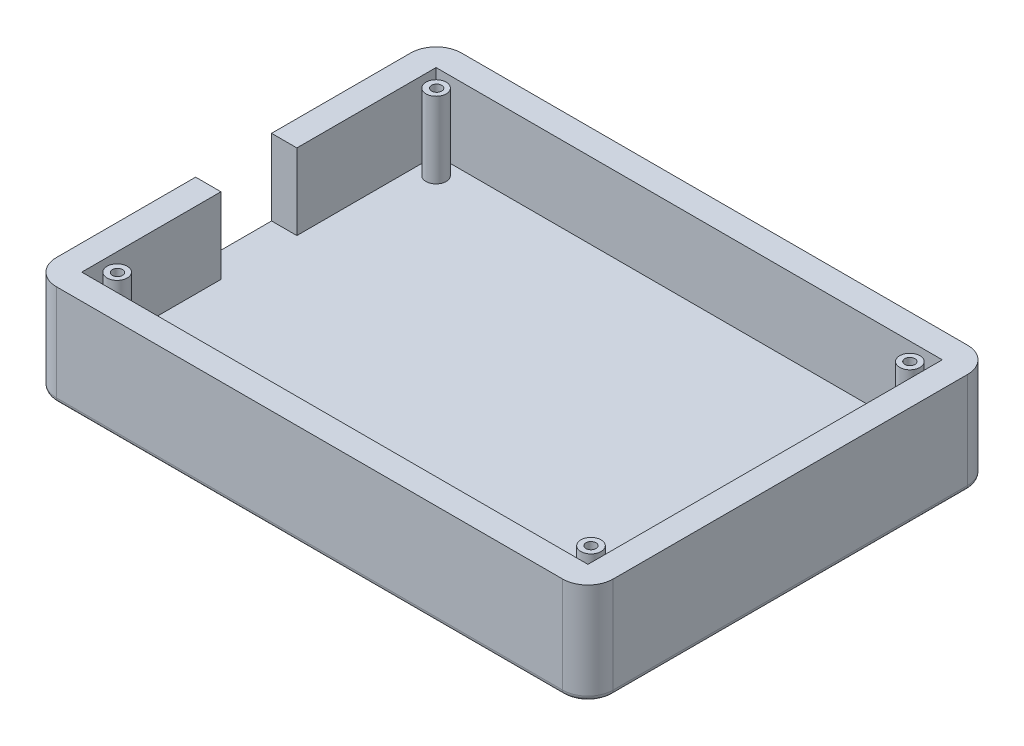
from build123d import *

# Parameters (mm, degrees)
SKETCH4_W           = 110
SKETCH4_H           = 80
BOSS_EXTRUDE1_DEPTH = 20
SHELL1_T            = -5
FILLET1_R           = 5
SKETCH8_W           = 15
SKETCH8_H           = 15
CUT_EXTRUDE2_DEPTH  = 5
SKETCH10_R          = 2
SKETCH10_R_2        = 1
BOSS_EXTRUDE2_DEPTH = 15
FILLET2_R           = 1


with BuildPart() as part:
    # Sketch4 → Boss-Extrude1 (new body)
    with BuildSketch(Plane(origin=(0, 0, 0), x_dir=(1, 0, 0), z_dir=(0, 1, 0))):
        Rectangle(SKETCH4_W, SKETCH4_H)
    extrude(amount=BOSS_EXTRUDE1_DEPTH)

    # Shell1
    shell1_openings = [part.faces().sort_by_distance(p)[0] for p in [
        (0, 20, 0),
    ]]
    offset(amount=SHELL1_T, openings=shell1_openings, kind=Kind.INTERSECTION)

    # Fillet1
    fillet1_edges = [part.edges().sort_by_distance(p)[0] for p in [
        (55, 10, 40),
        (-55, 10, 40),
        (-55, 10, -40),
        (55, 10, -40),
    ]]
    fillet(fillet1_edges, radius=FILLET1_R)

    # Sketch8 → Cut-Extrude2 (cut)
    with BuildSketch(Plane.ZY.offset(55)):
        with Locations((0, 12.5)):
            Rectangle(SKETCH8_W, SKETCH8_H)
    extrude(amount=-CUT_EXTRUDE2_DEPTH, mode=Mode.SUBTRACT)

    # Sketch10 → Boss-Extrude2 (add)
    # profile 1 of 4: a face of its own
    with BuildSketch(Plane(origin=(0, 5, 0), x_dir=(1, 0, 0), z_dir=(0, 1, 0))):
        with Locations(Location((47.1, 31.5, 0), (0, 0, 90))):
            Circle(SKETCH10_R)
        with Locations(Location((47.1, 31.5, 0), (0, 0, 90))):
            Circle(SKETCH10_R_2, mode=Mode.SUBTRACT)
    # profile 2 of 4: a face of its own
    with BuildSketch(Plane(origin=(0, 5, 0), x_dir=(1, 0, 0), z_dir=(0, 1, 0))):
        with Locations(Location((47.1, -31.5, 0), (0, 0, 90))):
            Circle(SKETCH10_R)
        with Locations(Location((47.1, -31.5, 0), (0, 0, 90))):
            Circle(SKETCH10_R_2, mode=Mode.SUBTRACT)
    # profile 3 of 4: a face of its own
    with BuildSketch(Plane(origin=(0, 5, 0), x_dir=(1, 0, 0), z_dir=(0, 1, 0))):
        with Locations(Location((-46.5, 31.5, 0), (0, 0, 90))):
            Circle(SKETCH10_R)
        with Locations(Location((-46.412417336, 31.528728885, 0), (0, 0, 90))):
            Circle(SKETCH10_R_2, mode=Mode.SUBTRACT)
    # profile 4 of 4: a face of its own
    with BuildSketch(Plane(origin=(0, 5, 0), x_dir=(1, 0, 0), z_dir=(0, 1, 0))):
        with Locations(Location((-46.5, -31.5, 0), (0, 0, 90))):
            Circle(SKETCH10_R)
        with Locations(Location((-46.412417336, -31.528728885, 0), (0, 0, 90))):
            Circle(SKETCH10_R_2, mode=Mode.SUBTRACT)
    extrude(amount=BOSS_EXTRUDE2_DEPTH)

    # Fillet2
    fillet2_edges = [part.edges().sort_by_distance(p)[0] for p in [
        (-55, 0, 0),
        (55, 0, 0),
        (0, 0, 40),
        (0, 0, -40),
        (-53.535533906, 0, 38.535533906),
        (53.535533906, 0, 38.535533906),
        (53.535533906, 0, -38.535533906),
        (-53.535533906, 0, -38.535533906),
    ]]
    fillet(fillet2_edges, radius=FILLET2_R)


solid = part.part
